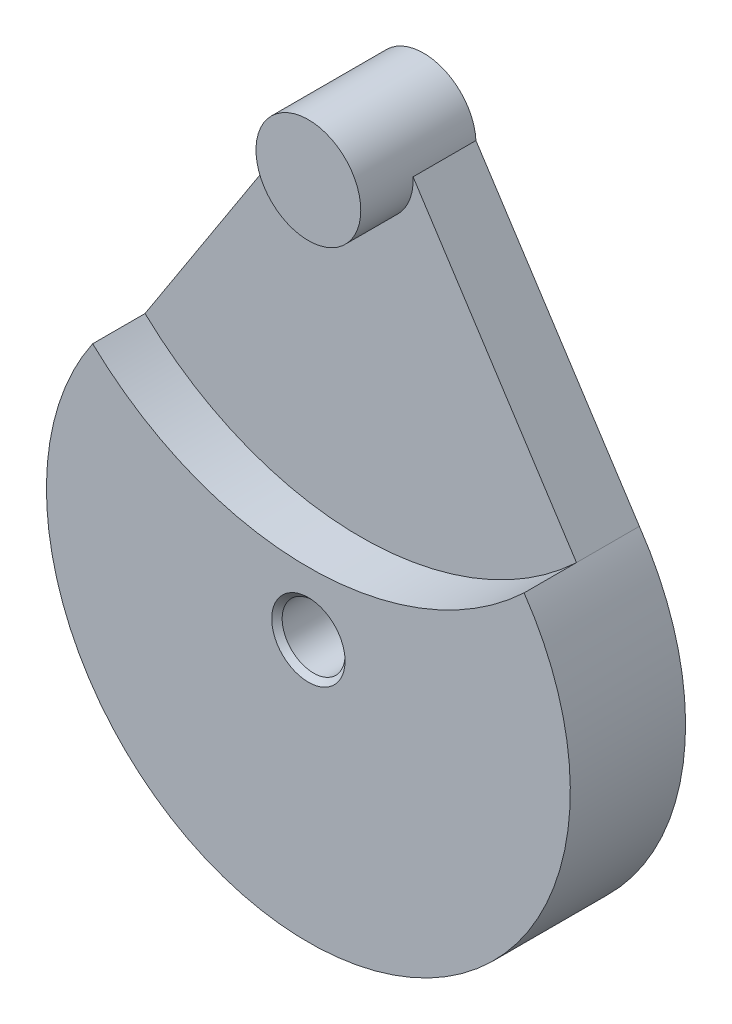
from build123d import *
from build123d.topology import SkipClean

# Parameters (mm, degrees)
SKETCH1_R               = 50
BOSS_EXTRUDE1_DEPTH     = 6
SKETCH2_R               = 4.999999999999999
BOSS_EXTRUDE2_DEPTH     = 5
SKETCH3_R               = 3
CUT_EXTRUDE1_DEPTH      = 72.56116265125938
CUT_EXTRUDE2_DEPTH      = 71.96477999684069
CUT_EXTRUDE2_DEPTH_BACK = 31
SKETCH4_R               = 50
CHAMFER1_SIZE           = 0.5


with BuildPart() as part:
    # Sketch1 → Boss-Extrude1 (new body)
    with BuildSketch(Plane.XY):
        Circle(SKETCH1_R)
    extrude(amount=BOSS_EXTRUDE1_DEPTH)

    # Sketch2 → Boss-Extrude2 (add)
    with BuildSketch(Plane.XY.offset(6)):
        with Locations((0, 38)):
            Circle(SKETCH2_R)
        with BuildLine():
            ThreePointArc((-20.589119557081666, 14.180555555555557), (-4.59e-15, -25.000000000000007), (20.589119557081666, 14.180555555555557))
            ThreePointArc((20.589119557081666, 14.180555555555557), (-4.82e-15, 5.9999999999999964), (-20.589119557081666, 14.180555555555557))
        make_face()
    extrude(amount=BOSS_EXTRUDE2_DEPTH)

    # Sketch3 → Cut-Extrude1 (cut, through all)
    with BuildSketch(Plane.XY.offset(11)):
        Circle(SKETCH3_R)
    extrude(amount=-CUT_EXTRUDE1_DEPTH, mode=Mode.SUBTRACT)

    # Sketch4 → Cut-Extrude2 (cut, two sides: drawn at the far end of the back side and taken through both)
    with SkipClean():  # the faces are left unmerged after this step: merging them gives an invalid solid
        with BuildSketch(Plane.XY.offset(6).offset(-CUT_EXTRUDE2_DEPTH_BACK)):
            Circle(SKETCH4_R)
            with BuildLine():
                ThreePointArc((20.58911955708167, 14.180555555555559), (8.9e-16, -25.000000000000014), (-20.58911955708167, 14.180555555555559))
                Line((-20.589119557081666, 14.180555555555562), (-4.992793047790904, 38.268360917297514))
                ThreePointArc((-4.9927930477907125, 38.268360917297436), (-4.1970479921117985, 40.71749667008265), (-2.2879979935196513, 42.44579185091363))
                ThreePointArc((-2.2879979935196513, 42.44579185091363), (-4.1769426665e-07, 42.999999999999986), (2.287997250726913, 42.44579223318703))
                ThreePointArc((2.287997250726913, 42.44579223318703), (4.1970479585600895, 40.71749672190172), (4.992793086001126, 38.26836020640056))
                Line((4.992793086001273, 38.268360206400615), (20.58911955708167, 14.180555555555559))
            make_face(mode=Mode.SUBTRACT)
        extrude(amount=CUT_EXTRUDE2_DEPTH + CUT_EXTRUDE2_DEPTH_BACK, mode=Mode.SUBTRACT)

    # Chamfer1
    chamfer1_edges = [part.edges().sort_by_distance(p)[0] for p in [
        (-3, 3.7e-16, 0),
        (-3, 3.7e-16, 11),
    ]]
    chamfer(chamfer1_edges, length=CHAMFER1_SIZE)


solid = part.part
